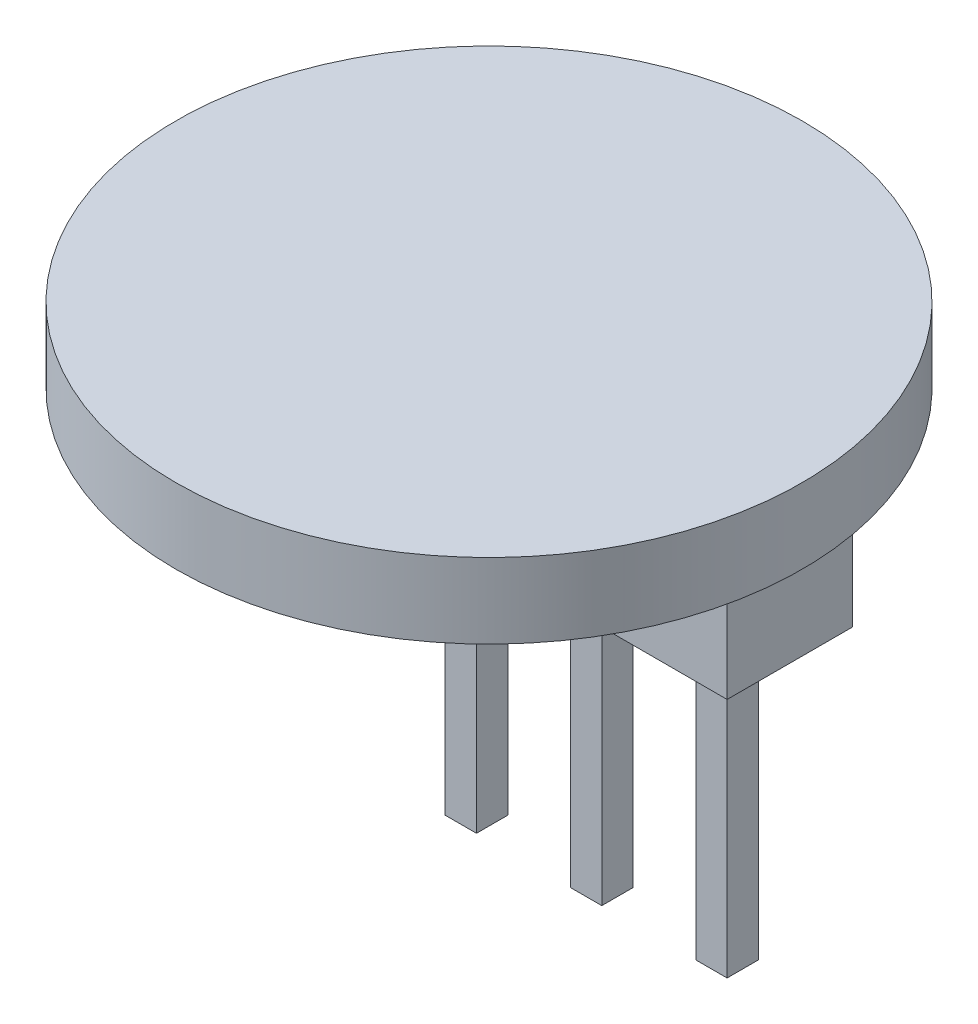
from build123d import *

# Parameters (mm, degrees)
SKETCH1_R           = 6.35
BOSS_EXTRUDE1_DEPTH = 1.52
SKETCH2_W           = 7.62
SKETCH2_H           = 2.54
BOSS_EXTRUDE2_DEPTH = 4.064
SKETCH3_W           = 0.635
SKETCH3_H           = 0.635
BOSS_EXTRUDE3_DEPTH = 5.842


with BuildPart() as part:
    # Sketch1 → Boss-Extrude1 (new body)
    with BuildSketch(Plane(origin=(0, 0, 0), x_dir=(1, 0, 0), z_dir=(0, 1, 0))):
        with Locations(Location((0, 0, 0), (0, 0, 270))):
            Circle(SKETCH1_R)
    extrude(amount=-BOSS_EXTRUDE1_DEPTH)

    # Sketch2 → Boss-Extrude2 (add)
    with BuildSketch(Plane.XZ.offset(1.52)):
        with Locations((0, -2.286)):
            Rectangle(SKETCH2_W, SKETCH2_H)
    extrude(amount=BOSS_EXTRUDE2_DEPTH)

    # Sketch3 → Boss-Extrude3 (add)
    with BuildSketch(Plane.XZ.offset(5.584)):
        with Locations((0, -2.286)):
            Rectangle(SKETCH3_W, SKETCH3_H)
        with Locations((-2.54, -2.286)):
            Rectangle(SKETCH3_W, SKETCH3_H)
        with Locations((2.54, -2.286)):
            Rectangle(SKETCH3_W, SKETCH3_H)
    extrude(amount=BOSS_EXTRUDE3_DEPTH)


solid = part.part
